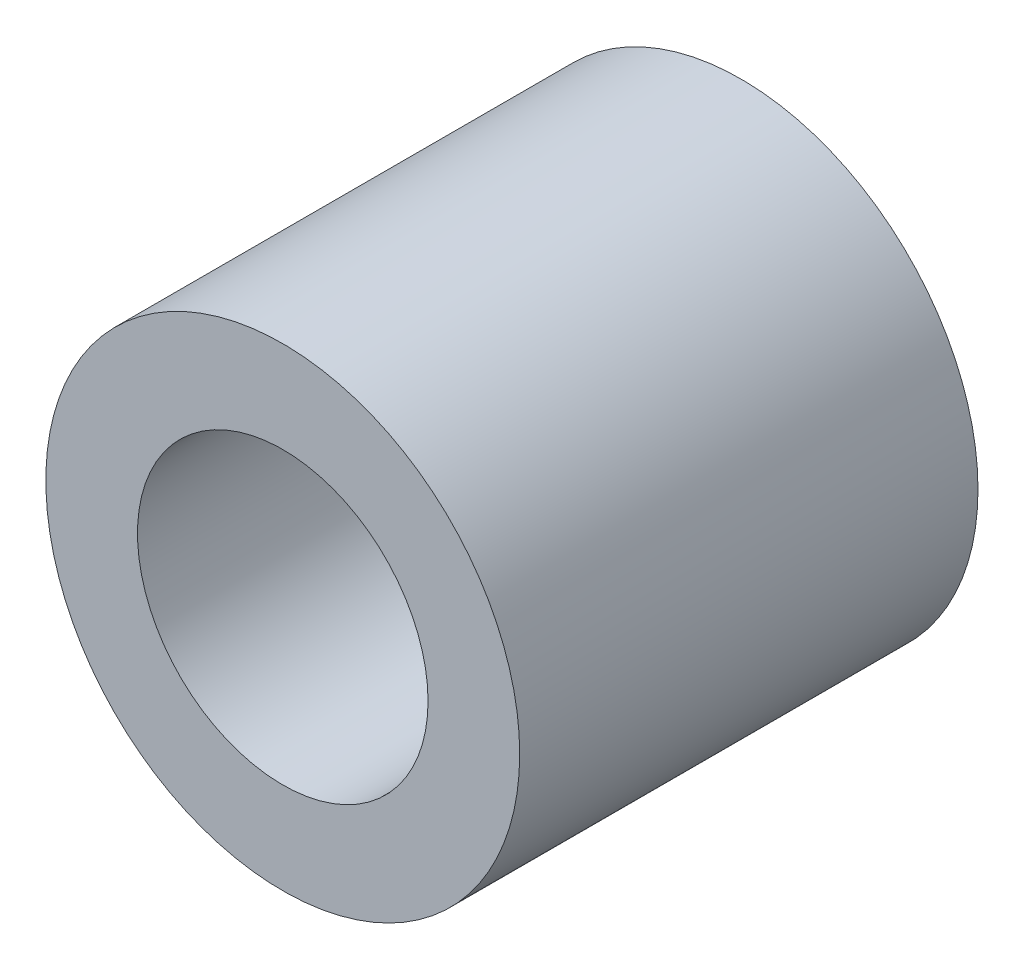
from build123d import *

# Parameters (mm, degrees)
SKETCH_1_R      = 2.585
SKETCH_1_R_2    = 1.585
EXTRUDE_1_DEPTH = 5


with BuildPart() as part:
    # 草图1 → 凸台-拉伸1 (new body)
    with BuildSketch(Plane.XY):
        Circle(SKETCH_1_R)
        Circle(SKETCH_1_R_2, mode=Mode.SUBTRACT)
    extrude(amount=EXTRUDE_1_DEPTH)


solid = part.part
